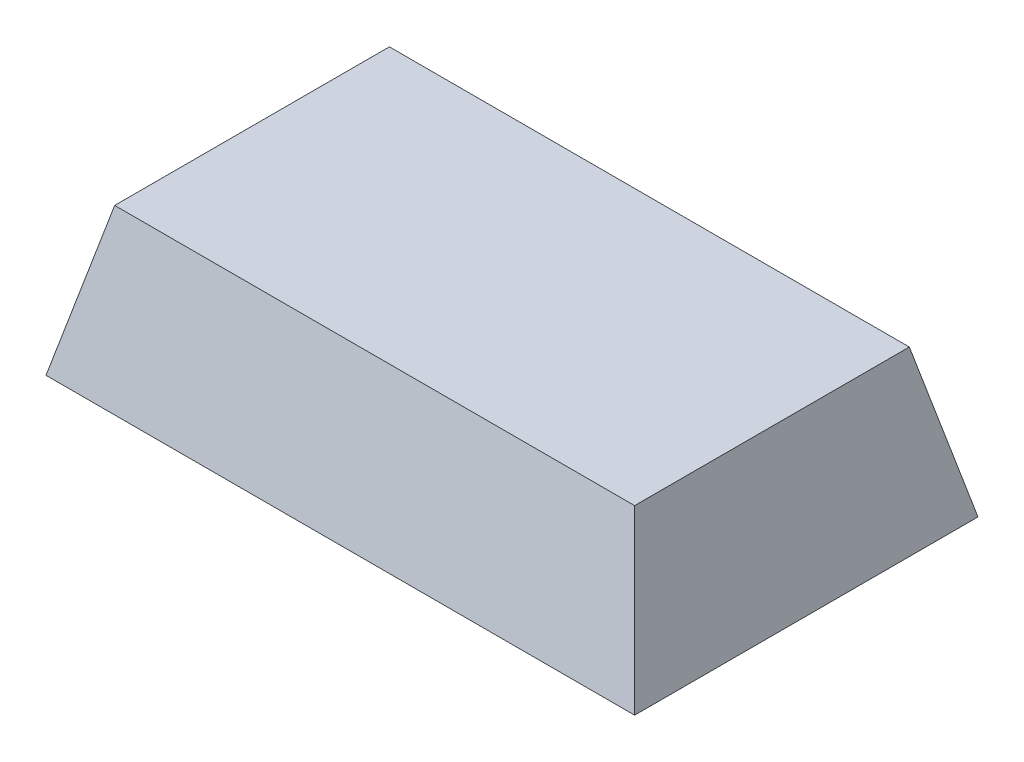
from build123d import *

# Parameters (mm, degrees)
SKETCH1_W               = 12
SKETCH1_H               = 7
BOSS_EXTRUDE1_DEPTH     = 3
CUT_EXTRUDE1_DEPTH      = 7
CUT_EXTRUDE2_DEPTH      = 15.212670404
CUT_EXTRUDE2_DEPTH_BACK = 15.212670404
SKETCH4_R               = 1.8
CUT_EXTRUDE3_DEPTH      = 0.8


with BuildPart() as part:
    # Sketch1 → Boss-Extrude1 (new body)
    with BuildSketch(Plane(origin=(0, 0, 0), x_dir=(1, 0, 0), z_dir=(0, 1, 0))):
        with Locations((6, 3.5)):
            Rectangle(SKETCH1_W, SKETCH1_H)
    extrude(amount=BOSS_EXTRUDE1_DEPTH)

    # Sketch2 → Cut-Extrude1 (cut)
    with BuildSketch(Plane.XY):
        Polygon((0, 0), (0.7, 3), (0, 3), align=None)
        Polygon((12, 0), (11.3, 3), (12, 3), align=None)
    extrude(amount=-CUT_EXTRUDE1_DEPTH, mode=Mode.SUBTRACT)

    # Sketch3 → Cut-Extrude2 (cut, two sides: drawn at the far end of the back side and taken through both)
    with BuildSketch(Plane(origin=(0, 0, 0), x_dir=(0, 0, -1), z_dir=(1, 0, 0)).offset(-CUT_EXTRUDE2_DEPTH_BACK)):
        Polygon((0, 0), (0.7, 3), (0, 3), align=None)
        Polygon((7, 3), (6.3, 3), (7, 0), align=None)
    extrude(amount=CUT_EXTRUDE2_DEPTH + CUT_EXTRUDE2_DEPTH_BACK, mode=Mode.SUBTRACT)

    # Sketch4 → Cut-Extrude3 (cut)
    with BuildSketch(Plane.XZ):
        with Locations(Location((6, -3.5, 0), (0, 0, 270))):
            Circle(SKETCH4_R)
    extrude(amount=-CUT_EXTRUDE3_DEPTH, mode=Mode.SUBTRACT)


solid = part.part
